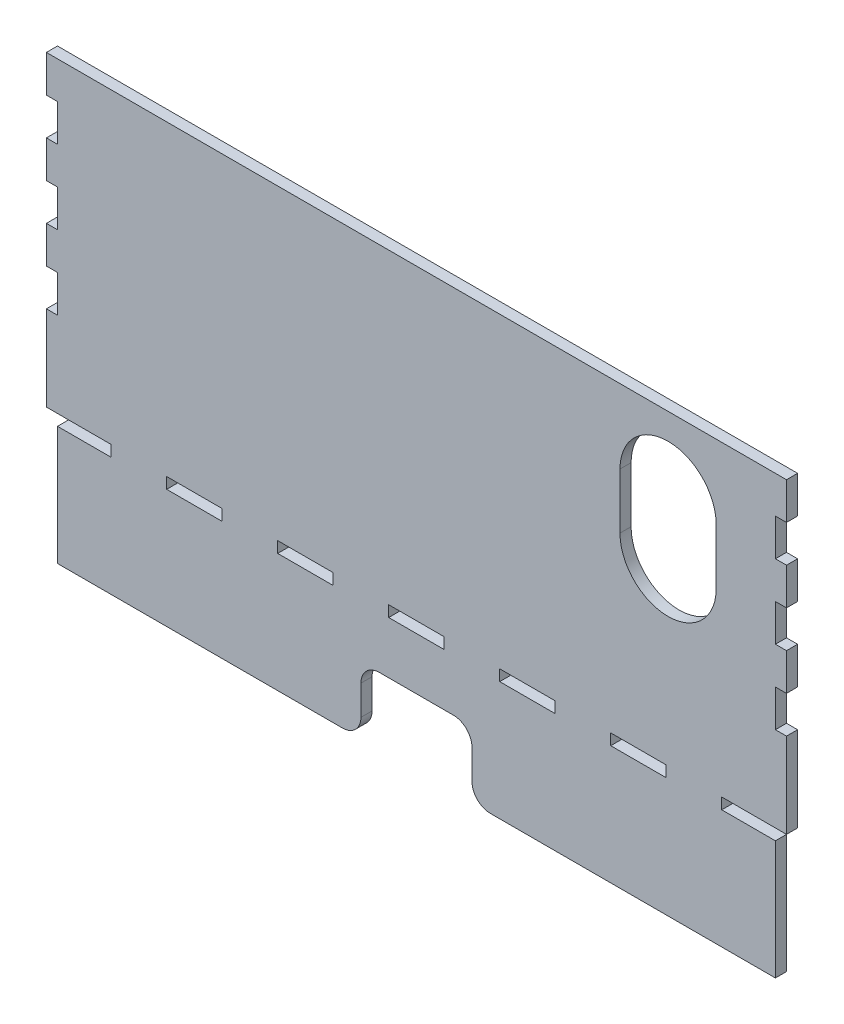
from build123d import *

# Parameters (mm, degrees)
BOSS_EXTRUDE1_DEPTH = 3
CUT_EXTRUDE1_DEPTH  = 10
SKETCH3_W           = 194
SKETCH3_H           = 3
BOSS_EXTRUDE2_DEPTH = 32.11
SKETCH4_W           = 30
SKETCH4_H           = 18
CUT_EXTRUDE2_DEPTH  = 22
FILLET1_R           = 5
FILLET2_R           = 5


with BuildPart() as part:
    # Sketch1 → Boss-Extrude1 (new body)
    with BuildSketch(Plane.XY):
        Polygon((100, -2.5), (97, -2.5), (97, 7.5), (100, 7.5), (100, 17.5), (97, 17.5), (97, 27.5), (100, 27.5), (100, 37.5), (97, 37.5), (97, 47.5), (100, 47.5), (100, 57.5), (97, 57.5), (-97, 57.5), (-100, 57.5), (-100, 47.5), (-97, 47.5), (-97, 37.5), (-100, 37.5), (-100, 27.5), (-97, 27.5), (-97, 17.5), (-100, 17.5), (-100, 7.5), (-97, 7.5), (-97, -2.5), (-100, -2.5), (-100, -25.5), (-97, -25.5), (-82.5, -25.5), (-82.5, -28.5), (-67.5, -28.5), (-67.5, -25.5), (-52.5, -25.5), (-52.5, -28.5), (-37.5, -28.5), (-37.5, -25.5), (-22.5, -25.5), (-22.5, -28.5), (-7.5, -28.5), (-7.5, -25.5), (0, -25.5), (7.5, -25.5), (7.5, -28.5), (22.5, -28.5), (22.5, -25.5), (30, -25.5), (37.5, -25.5), (37.5, -28.5), (52.5, -28.5), (52.5, -25.5), (60, -25.5), (67.5, -25.5), (67.5, -28.5), (82.5, -28.5), (82.5, -25.5), (97, -25.5), (100, -25.5), align=None)
    extrude(amount=BOSS_EXTRUDE1_DEPTH)

    # Sketch2 → Cut-Extrude1 (cut)
    with BuildSketch(Plane.XY.offset(3)):
        with BuildLine():
            Line((55, 22.5), (55, 37.5))
            ThreePointArc((55, 37.5), (68, 50.5), (81, 37.5))
            Line((81, 37.5), (81, 22.5))
            ThreePointArc((81, 22.5), (68, 9.5), (55, 22.5))
        make_face()
    extrude(amount=-CUT_EXTRUDE1_DEPTH, mode=Mode.SUBTRACT)

    # Sketch3 → Boss-Extrude2 (add)
    with BuildSketch(Plane.XZ.offset(28.5)):
        with Locations((0, 1.5)):
            Rectangle(SKETCH3_W, SKETCH3_H)
    extrude(amount=BOSS_EXTRUDE2_DEPTH)

    # Sketch4 → Cut-Extrude2 (cut)
    with BuildSketch(Plane.XY.offset(3)):
        with Locations((0, -51.61)):
            Rectangle(SKETCH4_W, SKETCH4_H)
    extrude(amount=-CUT_EXTRUDE2_DEPTH, mode=Mode.SUBTRACT)

    # Fillet1
    fillet1_edges = [part.edges().sort_by_distance(p)[0] for p in [
        (15, -60.61, 1.5),
        (-15, -60.61, 1.5),
    ]]
    fillet(fillet1_edges, radius=FILLET1_R)

    # Fillet2
    fillet2_edges = [part.edges().sort_by_distance(p)[0] for p in [
        (-15, -42.61, 1.5),
        (15, -42.61, 1.5),
    ]]
    fillet(fillet2_edges, radius=FILLET2_R)


solid = part.part
